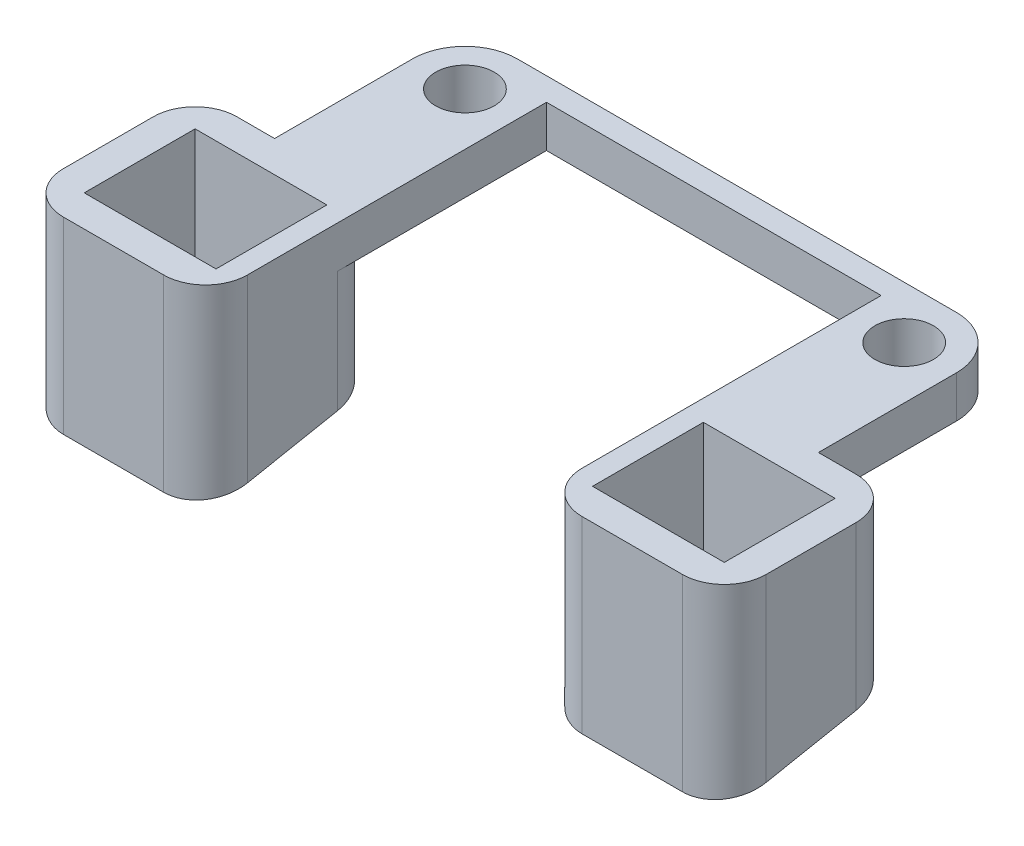
from build123d import *

# Parameters (mm, degrees)
SKETCH1_R           = 1.4
BOSS_EXTRUDE1_DEPTH = 2
FILLET1_R           = 2.5
SKETCH2_W           = 8.8
SKETCH2_H           = 8.3
SKETCH2_W_2         = 6.3
SKETCH2_H_2         = 5.3
BOSS_EXTRUDE2_DEPTH = 9
CUT_EXTRUDE1_DEPTH  = 36.921024484
FILLET2_R           = 2


with BuildPart() as part:
    # Sketch1 → Boss-Extrude1 (new body)
    with BuildSketch(Plane(origin=(0, 0, 0), x_dir=(1, 0, 0), z_dir=(0, 1, 0))):
        Polygon((-13, 0), (-13, 10.6), (13, 10.6), (13, 0), (8, 0), (8, 9.5), (-8, 9.5), (-8, 0), align=None)
        with Locations(Location((-10.5, 8.1, 0), (0, 0, 270))):
            Circle(SKETCH1_R, mode=Mode.SUBTRACT)
        with Locations(Location((10.5, 8.1, 0), (0, 0, 270))):
            Circle(SKETCH1_R, mode=Mode.SUBTRACT)
    extrude(amount=BOSS_EXTRUDE1_DEPTH)

    # Fillet1
    fillet1_edges = [part.edges().sort_by_distance(p)[0] for p in [
        (-13, 1, -10.6),
        (13, 1, -10.6),
    ]]
    fillet(fillet1_edges, radius=FILLET1_R)

    # Sketch2 → Boss-Extrude2 (add)
    # profile 1 of 2: a face of its own
    with BuildSketch(Plane(origin=(0, 2, 0), x_dir=(1, 0, 0), z_dir=(0, 1, 0))):
        with Locations((-12.4, -2.65)):
            Rectangle(SKETCH2_W, SKETCH2_H)
        with Locations((-12.15, -2.65)):
            Rectangle(SKETCH2_W_2, SKETCH2_H_2, mode=Mode.SUBTRACT)
    # profile 2 of 2: a face of its own
    with BuildSketch(Plane(origin=(0, 2, 0), x_dir=(1, 0, 0), z_dir=(0, 1, 0))):
        with Locations((12.4, -2.65)):
            Rectangle(SKETCH2_W, SKETCH2_H)
        with Locations((12.15, -2.65)):
            Rectangle(SKETCH2_W_2, SKETCH2_H_2, mode=Mode.SUBTRACT)
    extrude(amount=-BOSS_EXTRUDE2_DEPTH)

    # Sketch3 → Cut-Extrude1 (cut, through all)
    with BuildSketch(Plane.ZY.offset(16.8)):
        Polygon((-37.097656143, -7), (-1.5, -7), (6.8, -7), (-1.5, -5.39), (-36.44627134, 1.388734561), (-107.427912809, 6.900455328), (-108.079297611, -1.488279233), align=None)
    extrude(amount=-CUT_EXTRUDE1_DEPTH, mode=Mode.SUBTRACT)

    # Fillet2
    fillet2_edges = [part.edges().sort_by_distance(p)[0] for p in [
        (16.8, -1.695, -1.5),
        (8, -2.695, -1.5),
        (-8, -2.695, -1.5),
        (-16.8, -1.695, -1.5),
        (-16.8, -2.5, 6.8),
        (-8, -2.5, 6.8),
        (16.8, -2.5, 6.8),
        (8, -2.5, 6.8),
    ]]
    fillet(fillet2_edges, radius=FILLET2_R)


solid = part.part
